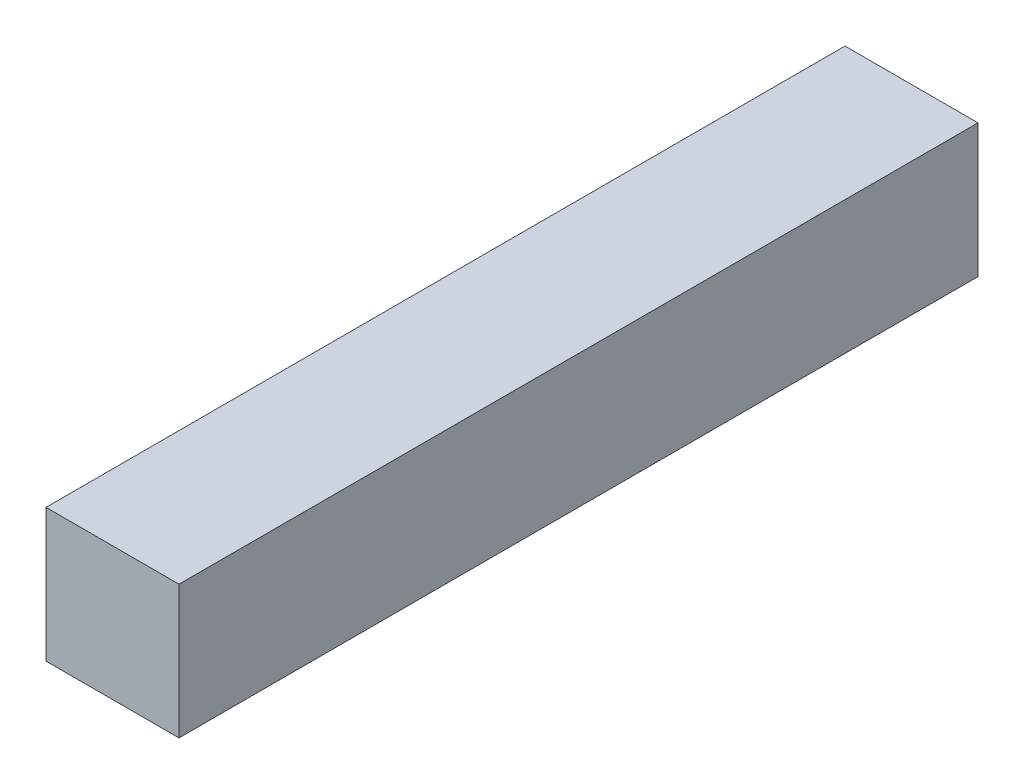
from build123d import *

# Parameters (mm, degrees)
SKETCH1_W           = 99.881007222
SKETCH1_H           = 100
BOSS_EXTRUDE1_DEPTH = 600


with BuildPart() as part:
    # Sketch1 → Boss-Extrude1 (new body)
    with BuildSketch(Plane.XY):
        with Locations((-49.940503611, -50)):
            Rectangle(SKETCH1_W, SKETCH1_H)
    extrude(amount=BOSS_EXTRUDE1_DEPTH)


solid = part.part
